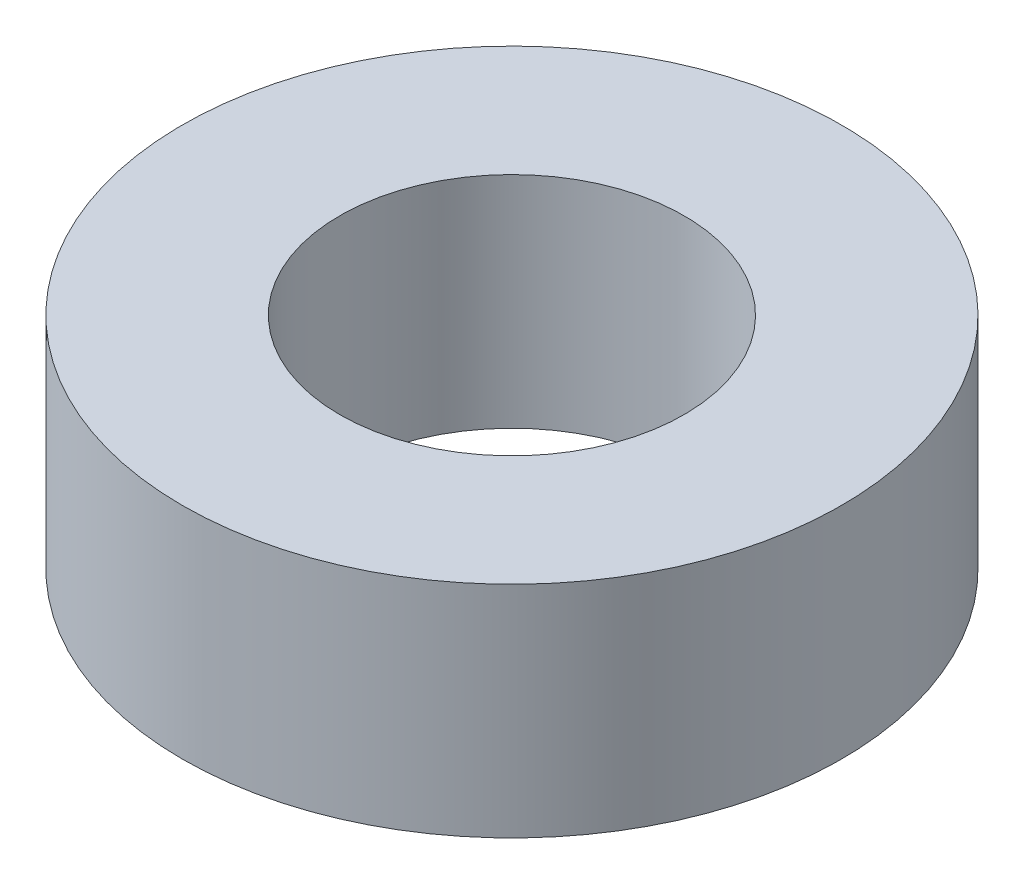
from build123d import *

# Parameters (mm, degrees)
SKETCH1_R           = 4.7625
SKETCH1_R_2         = 2.4892
BOSS_EXTRUDE1_DEPTH = 1.5875


with BuildPart() as part:
    # Sketch1 → Boss-Extrude1 (new, symmetric)
    with BuildSketch(Plane(origin=(0, 0, 0), x_dir=(1, 0, 0), z_dir=(0, 1, 0))):
        with Locations(Location((0, 0, 0), (0, 0, 270))):
            Circle(SKETCH1_R)
        with Locations(Location((0, 0, 0), (0, 0, 270))):
            Circle(SKETCH1_R_2, mode=Mode.SUBTRACT)
    extrude(amount=BOSS_EXTRUDE1_DEPTH, both=True)


solid = part.part
